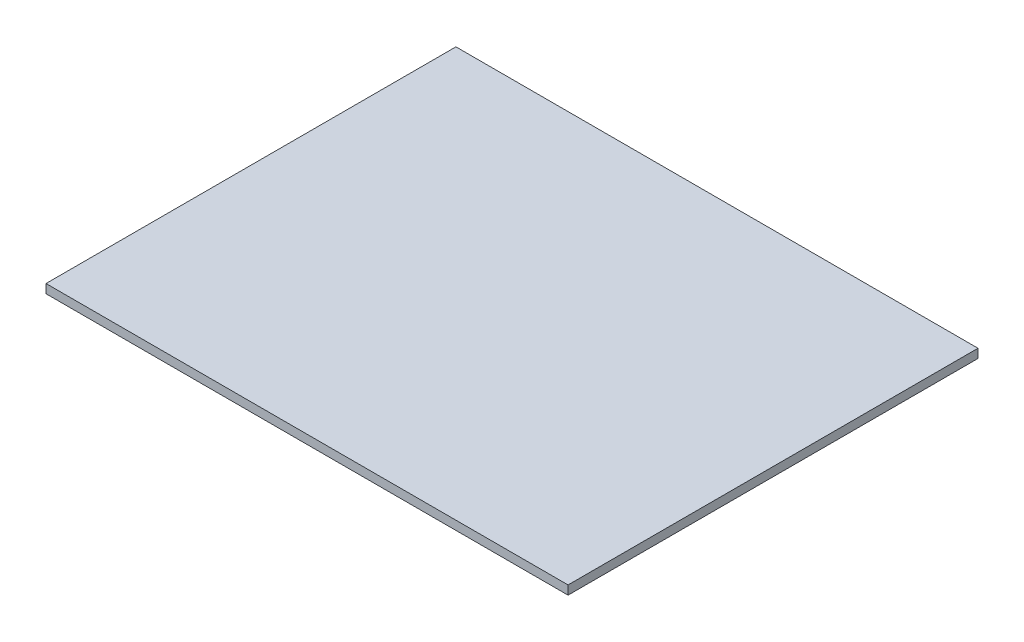
from build123d import *

# Parameters (mm, degrees)
SKETCH1_W           = 747.2426
SKETCH1_H           = 586.74
BOSS_EXTRUDE1_DEPTH = 12.7


with BuildPart() as part:
    # Sketch1 → Boss-Extrude1 (new body)
    with BuildSketch(Plane.XZ.offset(-263.686749239)):
        with Locations((392.915001613, 775.83385267)):
            Rectangle(SKETCH1_W, SKETCH1_H)
    extrude(amount=-BOSS_EXTRUDE1_DEPTH)


solid = part.part
